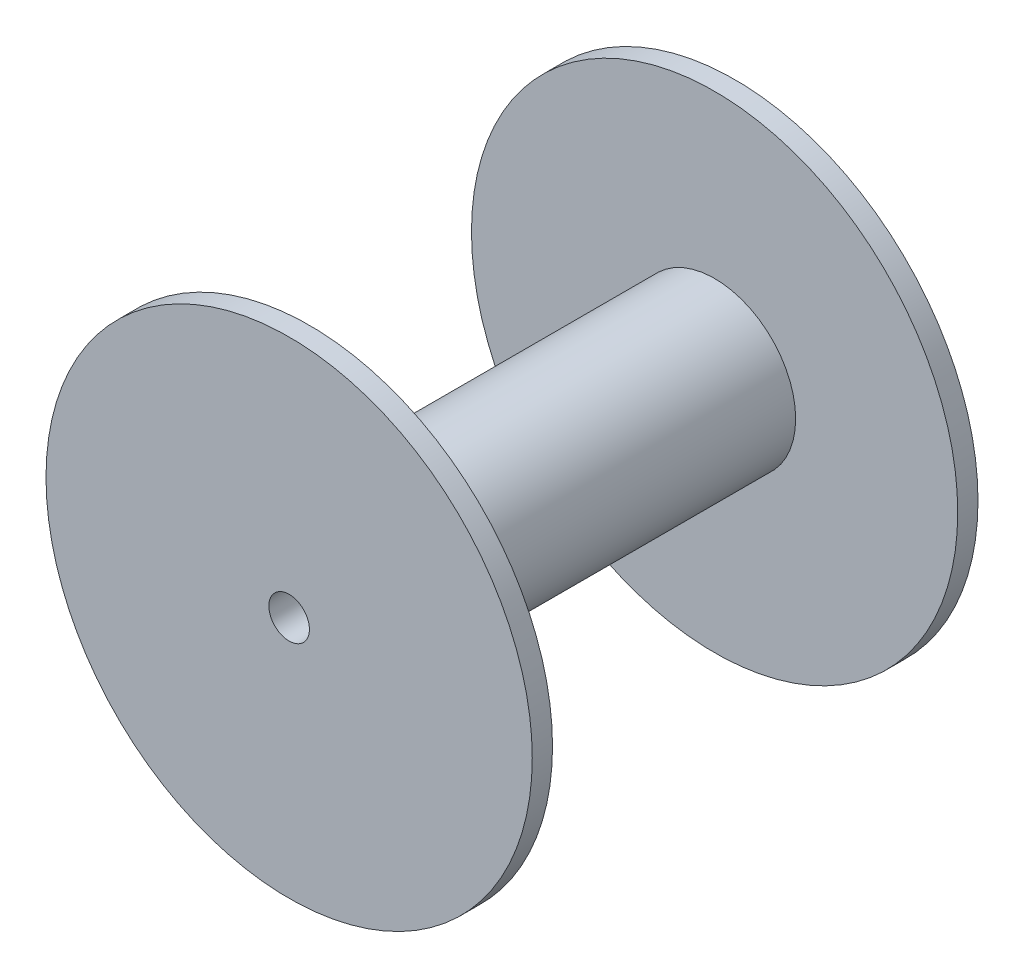
from build123d import *

# Parameters (mm, degrees)
SKETCH2_R           = 200
BOSS_EXTRUDE1_DEPTH = 1000
SKETCH3_R           = 600
BOSS_EXTRUDE2_DEPTH = 50
BOSS_EXTRUDE3_START = 50
SKETCH4_R           = 600
BOSS_EXTRUDE3_DEPTH = 50
SKETCH5_R           = 50
CUT_EXTRUDE1_DEPTH  = 1390.244398945


with BuildPart() as part:
    # Sketch2 → Boss-Extrude1 (new body)
    with BuildSketch(Plane.XY):
        Circle(SKETCH2_R)
    extrude(amount=BOSS_EXTRUDE1_DEPTH)

    # Sketch3 → Boss-Extrude2 (add)
    with BuildSketch(Plane.XY.offset(1000)):
        Circle(SKETCH3_R)
    extrude(amount=BOSS_EXTRUDE2_DEPTH)

    # Sketch4 → Boss-Extrude3 (add)
    with BuildSketch(Plane(origin=(0, 0, 0), x_dir=(-1, 0, 0), z_dir=(0, 0, -1)).offset(BOSS_EXTRUDE3_START)):
        with Locations(Location((0, 0, 0), (0, 0, 180))):
            Circle(SKETCH4_R)
    extrude(amount=-BOSS_EXTRUDE3_DEPTH)

    # Sketch5 → Cut-Extrude1 (cut, through all)
    with BuildSketch(Plane.XY.offset(1050)):
        Circle(SKETCH5_R)
    extrude(amount=-CUT_EXTRUDE1_DEPTH, mode=Mode.SUBTRACT)


solid = part.part
